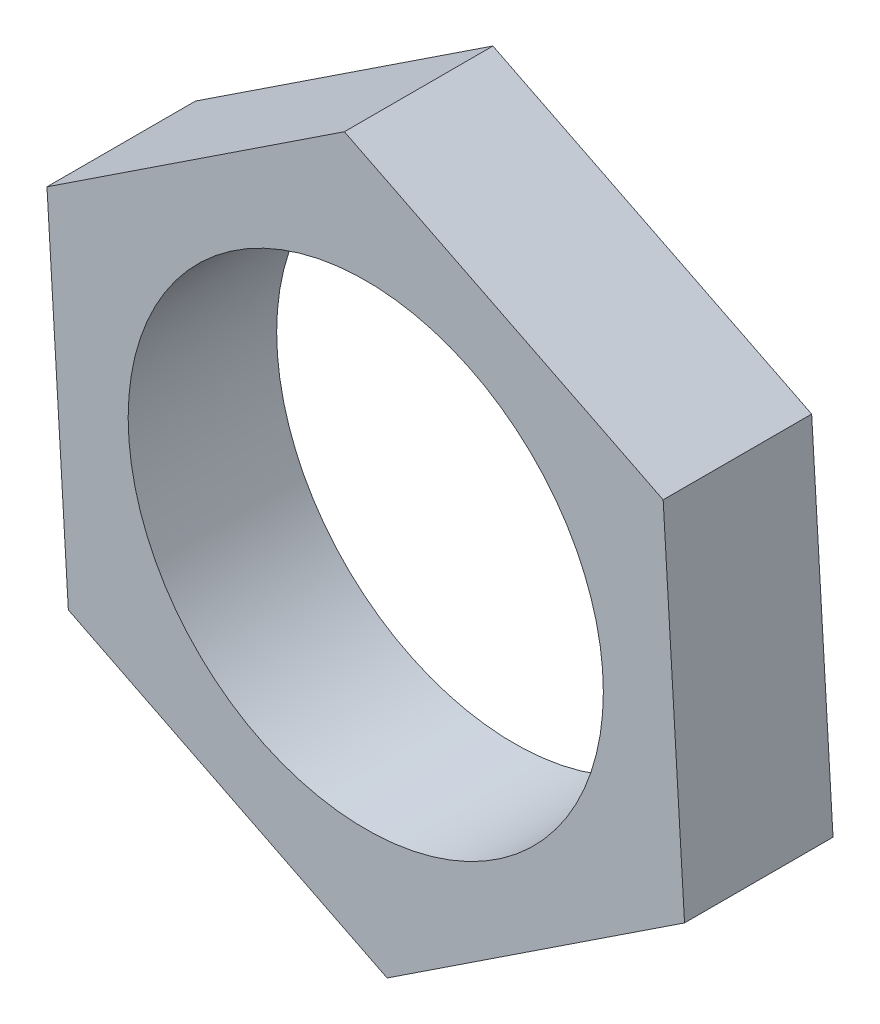
from build123d import *

# Parameters (mm, degrees)
SKETCH1_R           = 8
BOSS_EXTRUDE1_DEPTH = 5


with BuildPart() as part:
    # Sketch1 → Boss-Extrude1 (new body)
    with BuildSketch(Plane.XY):
        Polygon((-0.719550981, 11.978407506), (-10.733380688, 5.366054324), (-10.013829707, -6.612353182), (0.719550981, -11.978407506), (10.733380688, -5.366054324), (10.013829707, 6.612353182), align=None)
        Circle(SKETCH1_R, mode=Mode.SUBTRACT)
    extrude(amount=BOSS_EXTRUDE1_DEPTH)


solid = part.part
